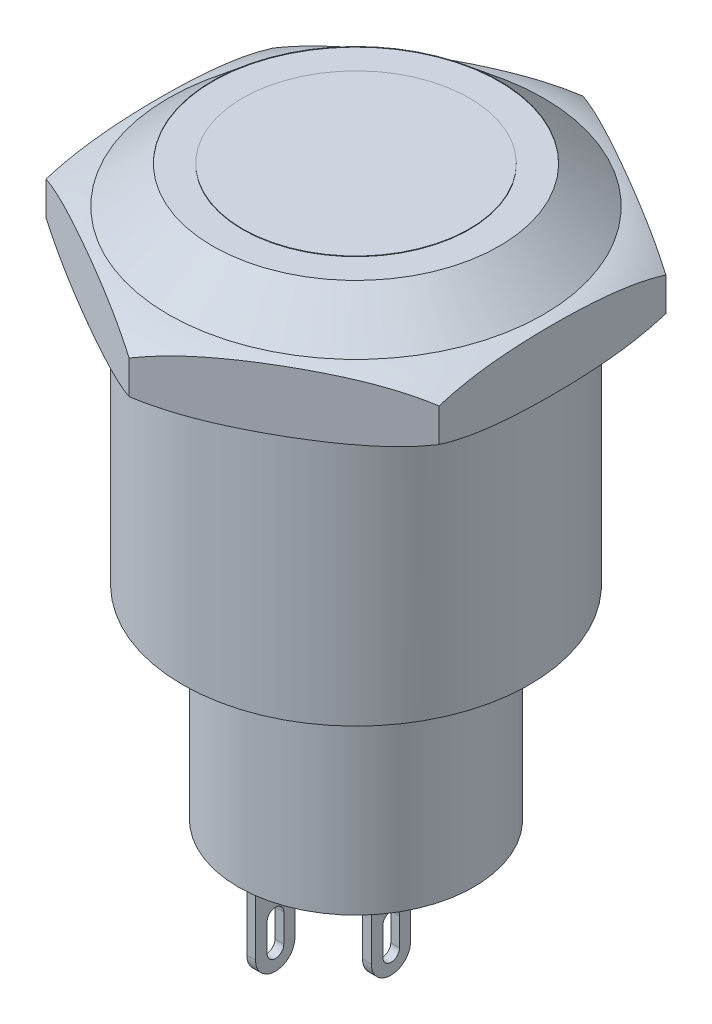
from build123d import *

# Parameters (mm, degrees)
BOSS_EXTRUDE1_DEPTH = 3.175
SKETCH2_R           = 7.95
BOSS_EXTRUDE2_DEPTH = 11.825
SKETCH3_R           = 5.4
BOSS_EXTRUDE3_DEPTH = 9.3
SKETCH4_W           = 0.4
SKETCH4_H           = 1.8
BOSS_EXTRUDE4_DEPTH = 5.4
FILLET1_R           = 0.889
CUT_EXTRUDE1_DEPTH  = 31.396309398
SKETCH6_R           = 8.589918765
BOSS_EXTRUDE5_DEPTH = 1.7
BOSS_EXTRUDE5_TAPER = 50
SKETCH8_R           = 6.563937658
SKETCH8_R_2         = 5.1943
CUT_EXTRUDE2_DEPTH  = 0.0254


with BuildPart() as part:
    # Sketch1 → Boss-Extrude1 (new body)
    with BuildSketch(Plane(origin=(0, 0, 0), x_dir=(1, 0, 0), z_dir=(0, 1, 0))):
        Polygon((9, 5.196152423), (0, 10.392304845), (-9, 5.196152423), (-9, -5.196152423), (0, -10.392304845), (9, -5.196152423), align=None)
    extrude(amount=BOSS_EXTRUDE1_DEPTH)

    # Sketch2 → Boss-Extrude2 (add)
    with BuildSketch(Plane.XZ):
        with Locations(Location((0, 0, 0), (0, 0, 90))):
            Circle(SKETCH2_R)
    extrude(amount=BOSS_EXTRUDE2_DEPTH)

    # Sketch3 → Boss-Extrude3 (add)
    with BuildSketch(Plane.XZ.offset(11.825)):
        with Locations(Location((0, 0, 0), (0, 0, 90))):
            Circle(SKETCH3_R)
    extrude(amount=BOSS_EXTRUDE3_DEPTH)

    # Sketch4 → Boss-Extrude4 (add)
    with BuildSketch(Plane.XZ.offset(21.125)):
        with Locations((-1.4, 2.5)):
            Rectangle(SKETCH4_W, SKETCH4_H)
        with Locations((-1.4, -2.5)):
            Rectangle(SKETCH4_W, SKETCH4_H)
        with Locations((1.4, 0)):
            Rectangle(SKETCH4_W, SKETCH4_H)
    extrude(amount=BOSS_EXTRUDE4_DEPTH)

    # Fillet1
    fillet1_edges = [part.edges().sort_by_distance(p)[0] for p in [
        (-1.4, -26.525, 1.6),
        (-1.4, -26.525, 3.4),
        (-1.4, -26.525, -3.4),
        (-1.4, -26.525, -1.6),
        (1.4, -26.525, -0.9),
        (1.4, -26.525, 0.9),
    ]]
    fillet(fillet1_edges, radius=FILLET1_R)

    # Sketch5 → Cut-Extrude1 (cut, through all)
    with BuildSketch(Plane(origin=(1.6, 0, 0), x_dir=(0, 0, -1), z_dir=(1, 0, 0))):
        with BuildLine():
            Line((-0.37, -25.636), (-0.37, -24.366))
            ThreePointArc((-0.37, -24.366), (0.011, -23.985), (0.392, -24.366))
            Line((0.392, -24.366), (0.392, -25.636))
            ThreePointArc((0.392, -25.636), (0.011, -26.017), (-0.37, -25.636))
        make_face()
        with BuildLine():
            Line((-2.87, -25.636), (-2.87, -24.366))
            ThreePointArc((-2.87, -24.366), (-2.489, -23.985), (-2.108, -24.366))
            Line((-2.108, -24.366), (-2.108, -25.636))
            ThreePointArc((-2.108, -25.636), (-2.489, -26.017), (-2.87, -25.636))
        make_face()
        with BuildLine():
            Line((2.108, -25.636), (2.108, -24.366))
            ThreePointArc((2.108, -24.366), (2.489, -23.985), (2.87, -24.366))
            Line((2.87, -24.366), (2.87, -25.636))
            ThreePointArc((2.87, -25.636), (2.489, -26.017), (2.108, -25.636))
        make_face()
    extrude(amount=-CUT_EXTRUDE1_DEPTH, mode=Mode.SUBTRACT)

    # Sketch6 → Boss-Extrude5 (add)
    with BuildSketch(Plane(origin=(0, 3.175, 0), x_dir=(1, 0, 0), z_dir=(0, 1, 0))):
        Circle(SKETCH6_R)
    extrude(amount=BOSS_EXTRUDE5_DEPTH, taper=BOSS_EXTRUDE5_TAPER)

    # Sketch7 → Cut-Revolve1 (revolve, cut)
    with BuildSketch(Plane(origin=(0, 0, 0), x_dir=(0, 0, -1), z_dir=(1, 0, 0))):
        with BuildLine():
            Line((7.885247447, 3.175), (10.392304845, 3.175))
            Line((10.392304845, 3.175), (10.392304845, 2.354871392))
            ThreePointArc((10.392304845, 2.354871392), (9.18924806, 2.919223674), (7.885247447, 3.175))
        make_face()
    cut_revolve1 = revolve(axis=Axis((0, 0, 0), (0, 1, 0)), mode=Mode.SUBTRACT)

    # Mirror1: Cut-Revolve1 across plane
    add(cut_revolve1.mirror(Plane(origin=(0, 1.5875, 0), x_dir=(0, 0, 1), z_dir=(0, -1, 0))), mode=Mode.SUBTRACT)

    # Sketch8 → Cut-Extrude2 (cut)
    with BuildSketch(Plane(origin=(0, 4.875, 0), x_dir=(1, 0, 0), z_dir=(0, 1, 0))):
        with Locations(Location((0, 0, 0), (0, 0, 270))):
            Circle(SKETCH8_R)
        with Locations(Location((0, 0, 0), (0, 0, 270))):
            Circle(SKETCH8_R_2, mode=Mode.SUBTRACT)
    extrude(amount=-CUT_EXTRUDE2_DEPTH, mode=Mode.SUBTRACT)


solid = part.part
